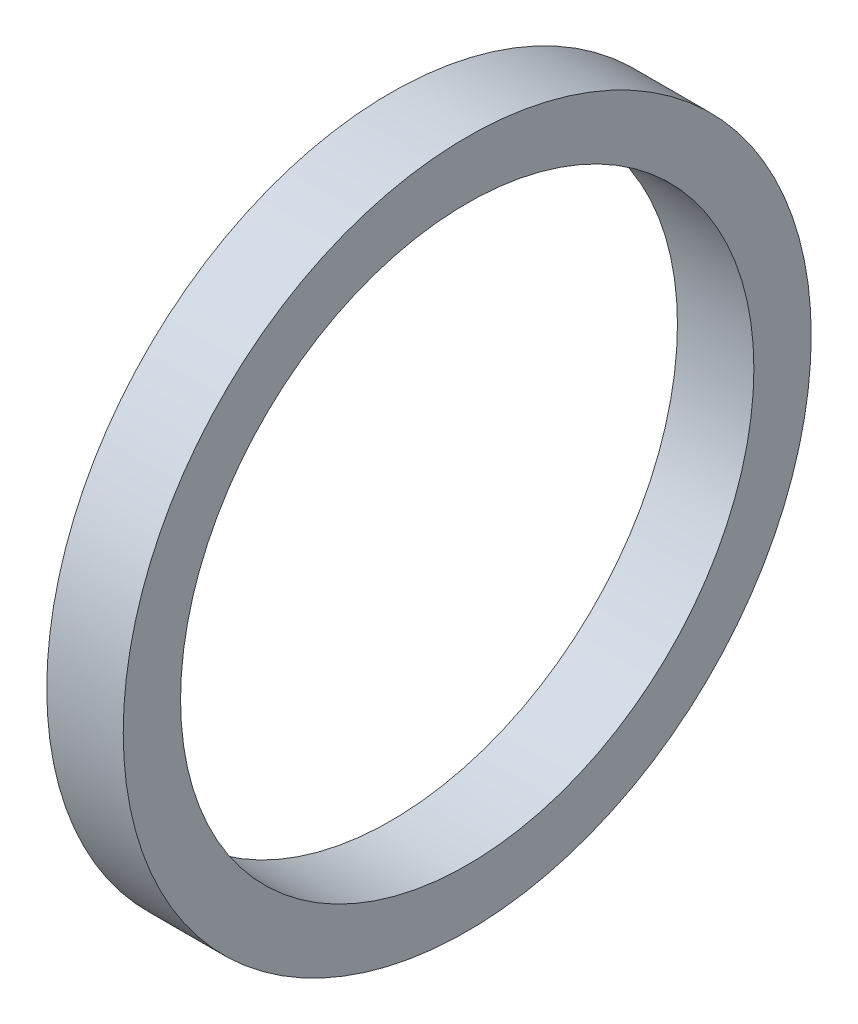
from build123d import *

# Parameters (mm, degrees)
SKETCH_1_W = 10
SKETCH_1_H = 7.5


with BuildPart() as part:
    # 草图1 → 旋转1 (revolve)
    with BuildSketch(Plane.XY, mode=Mode.PRIVATE) as revolve_1_sk:
        with Locations((5, 41.25)):
            Rectangle(SKETCH_1_W, SKETCH_1_H)
    revolve(revolve_1_sk.sketch.rotate(Axis((-59.659258107, 0, 0), (1, 0, 0)), 90), axis=Axis((-59.659258107, 0, 0), (1, 0, 0)))


solid = part.part
